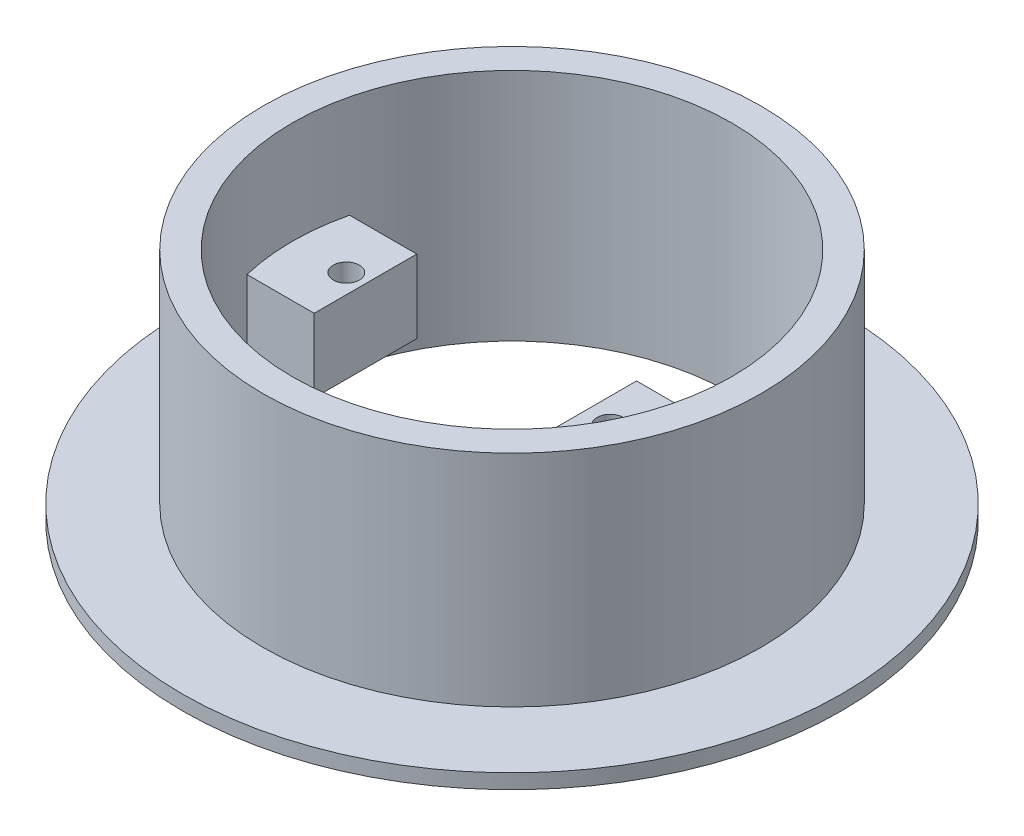
from build123d import *

# Parameters (mm, degrees)
SKETCH1_R           = 45
SKETCH1_R_2         = 30
BOSS_EXTRUDE1_DEPTH = 2
SKETCH2_R           = 34
SKETCH2_R_2         = 30
BOSS_EXTRUDE2_DEPTH = 30
SKETCH4_W           = 7
SKETCH4_H           = 18
SKETCH4_W_2         = 10
SKETCH4_H_2         = 10
BOSS_EXTRUDE4_DEPTH = 7
BOSS_EXTRUDE5_DEPTH = 2
SKETCH7_R           = 1.775
CUT_EXTRUDE1_DEPTH  = 8


with BuildPart() as part:
    # Sketch1 → Boss-Extrude1 (new body)
    with BuildSketch(Plane(origin=(0, 0, 0), x_dir=(1, 0, 0), z_dir=(0, 1, 0))):
        with Locations(Location((0, 0, 0), (0, 0, 270))):
            Circle(SKETCH1_R)
        with Locations(Location((0, 0, 0), (0, 0, 270))):
            Circle(SKETCH1_R_2, mode=Mode.SUBTRACT)
    extrude(amount=BOSS_EXTRUDE1_DEPTH)

    # Sketch2 → Boss-Extrude2 (add)
    with BuildSketch(Plane(origin=(0, 2, 0), x_dir=(1, 0, 0), z_dir=(0, 1, 0))):
        with Locations(Location((0, 0, 0), (0, 0, 270))):
            Circle(SKETCH2_R)
        with Locations(Location((0, 0, 0), (0, 0, 270))):
            Circle(SKETCH2_R_2, mode=Mode.SUBTRACT)
    extrude(amount=BOSS_EXTRUDE2_DEPTH)

    # Sketch4 → Boss-Extrude4 (add, symmetric)
    with BuildSketch(Plane.XY):
        with Locations((13.5, 9)):
            Rectangle(SKETCH4_W, SKETCH4_H)
        with Locations((-25, 13)):
            Rectangle(SKETCH4_W_2, SKETCH4_H_2)
    extrude(amount=BOSS_EXTRUDE4_DEPTH, both=True)


with BuildPart() as boss_extrude4_piece_1:
    # of the separate pieces the step leaves, piece 1, a body of its own (boss_extrude4_pieces)
    add(part.part.solids().sort_by_distance((0, 0, 45))[0])



with BuildPart() as boss_extrude4_piece_2:
    # of the separate pieces the step leaves, piece 2, a body of its own (boss_extrude4_pieces)
    add(part.part.solids().sort_by_distance((17, 18, -7))[0])


with BuildPart() as boss_extrude4_piece_1_1:
    add(boss_extrude4_piece_1.part)

    add(boss_extrude4_piece_2.part)  # Boss-Extrude5 merges Boss-Extrude4 piece 2
    # Sketch5 → Boss-Extrude5 (add)
    with BuildSketch(Plane(origin=(0, 0, 0.832419338), x_dir=(1, 0, 0), z_dir=(0, -1, 0))):
        with BuildLine():
            Line((9.016041177, 9.852910493), (26.659104244, 12.925929433))
            ThreePointArc((26.659104244, 12.925929433), (29.929900496, -1.405666291), (26.112718683, -15.601506072))
            Line((26.112718683, -15.601506072), (9.016041177, -12.303735496))
            Line((9.016041177, -12.303735496), (9.016041177, 9.852910493))
        make_face()
    extrude(amount=-BOSS_EXTRUDE5_DEPTH)

    # Sketch7 → Cut-Extrude1 (cut)
    with BuildSketch(Plane(origin=(0, 18, 0), x_dir=(1, 0, 0), z_dir=(0, 1, 0))):
        with Locations(Location((-22.611566211, 0, 0), (0, 0, 270))):
            Circle(SKETCH7_R)
        with Locations(Location((13.388433789, 0, 0), (0, 0, 270))):
            Circle(SKETCH7_R)
    extrude(amount=-CUT_EXTRUDE1_DEPTH, mode=Mode.SUBTRACT)


solid = boss_extrude4_piece_1_1.part
